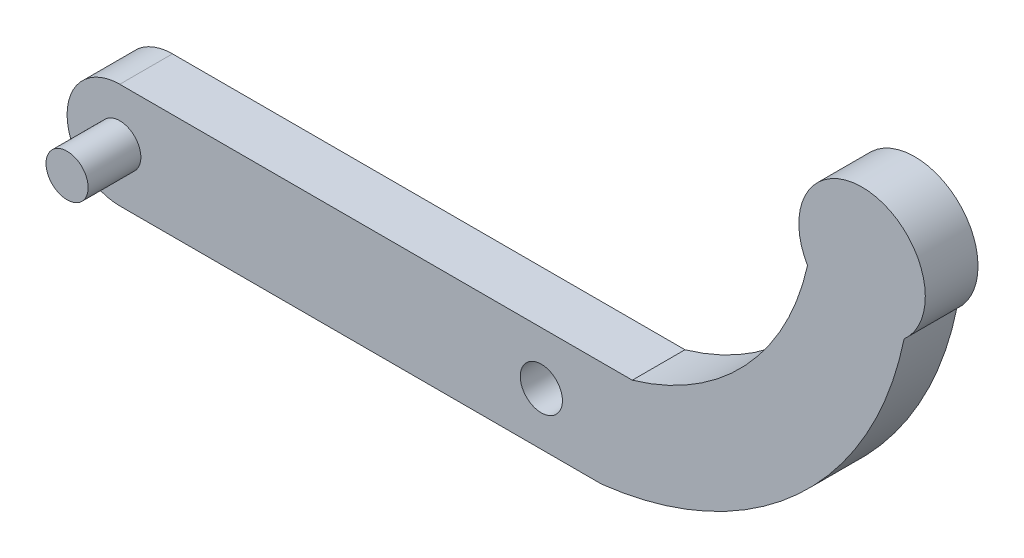
from build123d import *

# Parameters (mm, degrees)
SALIENTE_EXTRUIR1_DEPTH = 5
CROQUIS2_R              = 2
SALIENTE_EXTRUIR2_DEPTH = 10
CROQUIS4_R              = 2
CORTAR_EXTRUIR1_DEPTH   = 10


with BuildPart() as part:
    # Croquis1 → Saliente-Extruir1 (new body)
    with BuildSketch(Plane.XY):
        with BuildLine():
            Line((5.788348274, -6.740393182), (-39.936853781, -6.740393182))
            ThreePointArc((-39.936853781, -6.740393182), (-44.936853781, -1.740393182), (-39.936853781, 3.259606818))
            Line((-39.936853781, 3.259606818), (8.694861452, 3.259606818))
            ThreePointArc((8.694861452, 3.259606818), (19.436497165, 9.850973357), (25.319941104, 20.996104045))
            ThreePointArc((25.319941104, 20.996104045), (31.436981506, 29.954437164), (34.482454636, 19.543144787))
            ThreePointArc((34.482454636, 19.543144787), (24.402815118, 1.742580565), (5.788348274, -6.740393182))
        make_face()
    extrude(amount=SALIENTE_EXTRUIR1_DEPTH)

    # Croquis2 → Saliente-Extruir2 (add)
    with BuildSketch(Plane(origin=(0, 0, 0), x_dir=(-1, 0, 0), z_dir=(0, 0, -1))):
        with Locations((39.936853781, -1.740393182)):
            Circle(CROQUIS2_R)
    extrude(amount=-SALIENTE_EXTRUIR2_DEPTH)

    # Croquis4 → Cortar-Extruir1 (cut)
    with BuildSketch(Plane.XY.offset(5)):
        with Locations((0.063146219, -1.740393182)):
            Circle(CROQUIS4_R)
    extrude(amount=-CORTAR_EXTRUIR1_DEPTH, mode=Mode.SUBTRACT)


solid = part.part
